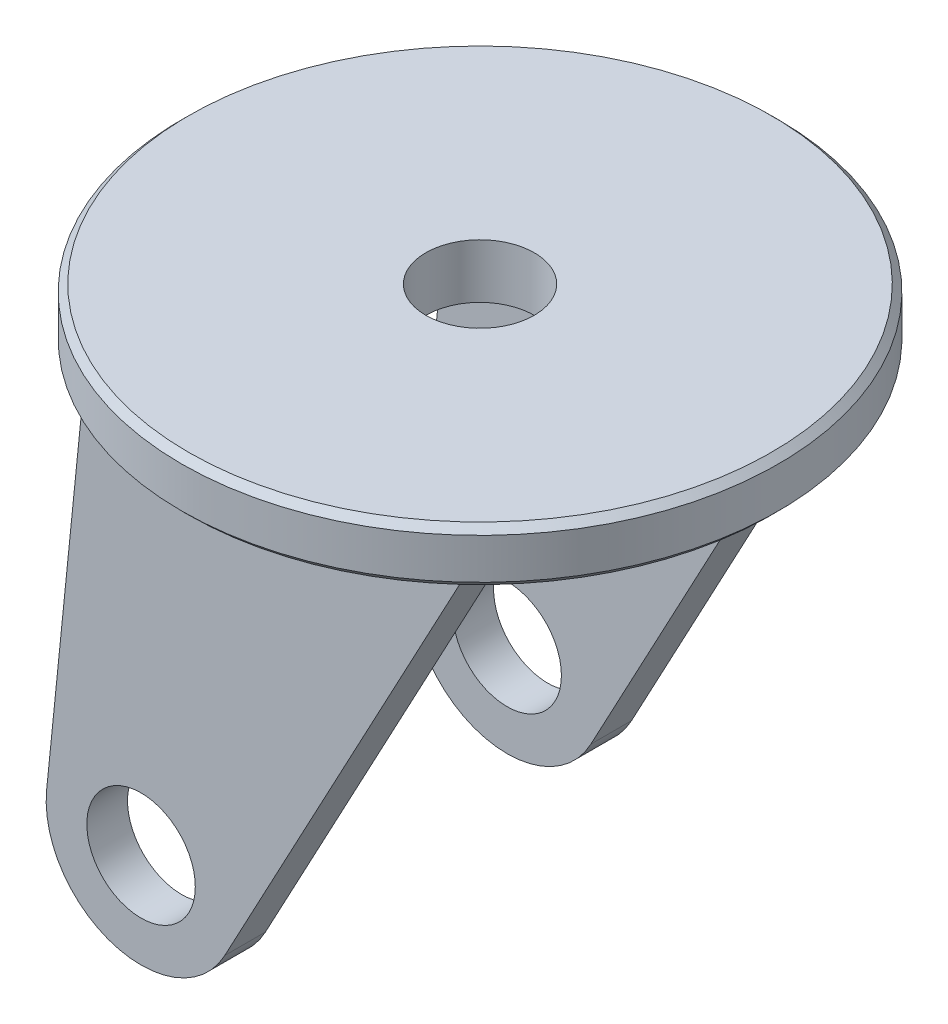
from build123d import *

# Parameters (mm, degrees)
SKETCH6_R           = 11
BOSS_EXTRUDE3_DEPTH = 2
CHAMFER3_SIZE       = 0.25
SKETCH7_R           = 2
BOSS_EXTRUDE4_DEPTH = 1.5
SKETCH8_R           = 2
CUT_EXTRUDE1_DEPTH  = 26.734218465


with BuildPart() as part:
    # Sketch6 → Boss-Extrude3 (new body)
    with BuildSketch(Plane(origin=(0, 0, 0), x_dir=(1, 0, 0), z_dir=(0, 1, 0))):
        with Locations(Location((0, 0, 0), (0, 0, 270))):
            Circle(SKETCH6_R)
    extrude(amount=BOSS_EXTRUDE3_DEPTH)

    # Chamfer3
    chamfer3_edges = [part.edges().sort_by_distance(p)[0] for p in [
        (0, 0, -11),
        (0, 2, -11),
    ]]
    chamfer(chamfer3_edges, length=CHAMFER3_SIZE)

    # Sketch7 → Boss-Extrude4 (add)
    with BuildSketch(Plane.XY.offset(6)):
        with BuildLine():
            Line((-7, 0), (7, 0))
            Line((7, 0), (-1.91433359, -16.651866461))
            ThreePointArc((-1.91433359, -16.651866461), (-6.021545449, -18.347602858), (-8.482216912, -14.647628922))
            Line((-8.482216912, -14.647628922), (-7, 0))
        make_face()
        with Locations((-5, -15)):
            Circle(SKETCH7_R, mode=Mode.SUBTRACT)
    boss_extrude4 = extrude(amount=BOSS_EXTRUDE4_DEPTH)

    # Mirror2: Boss-Extrude4 across plane
    add(boss_extrude4.mirror(Plane.XY))

    # Sketch8 → Cut-Extrude1 (cut, through all)
    with BuildSketch(Plane(origin=(0, 2, 0), x_dir=(1, 0, 0), z_dir=(0, 1, 0))):
        with Locations(Location((0, 0, 0), (0, 0, 270))):
            Circle(SKETCH8_R)
    extrude(amount=-CUT_EXTRUDE1_DEPTH, mode=Mode.SUBTRACT)


solid = part.part
